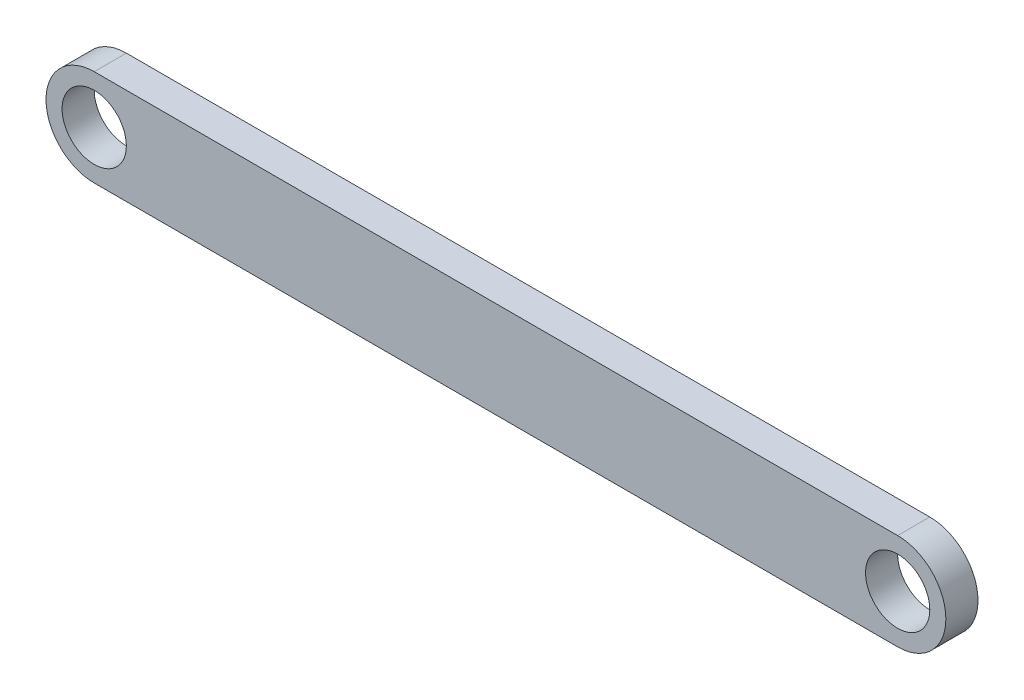
from build123d import *

# Parameters (mm, degrees)
SKETCH_1_R      = 10
EXTRUDE_1_DEPTH = 10


with BuildPart() as part:
    # Эскиз1 → Бобышка-Вытянуть1 (new body)
    with BuildSketch(Plane.XY):
        with BuildLine():
            Line((0, 15), (250, 15))
            ThreePointArc((250, 15), (265, 0), (250, -15))
            Line((250, -15), (0, -15))
            ThreePointArc((0, -15), (-15, 0), (0, 15))
        make_face()
        Circle(SKETCH_1_R, mode=Mode.SUBTRACT)
        with Locations((250, 0)):
            Circle(SKETCH_1_R, mode=Mode.SUBTRACT)
    extrude(amount=EXTRUDE_1_DEPTH)


solid = part.part
